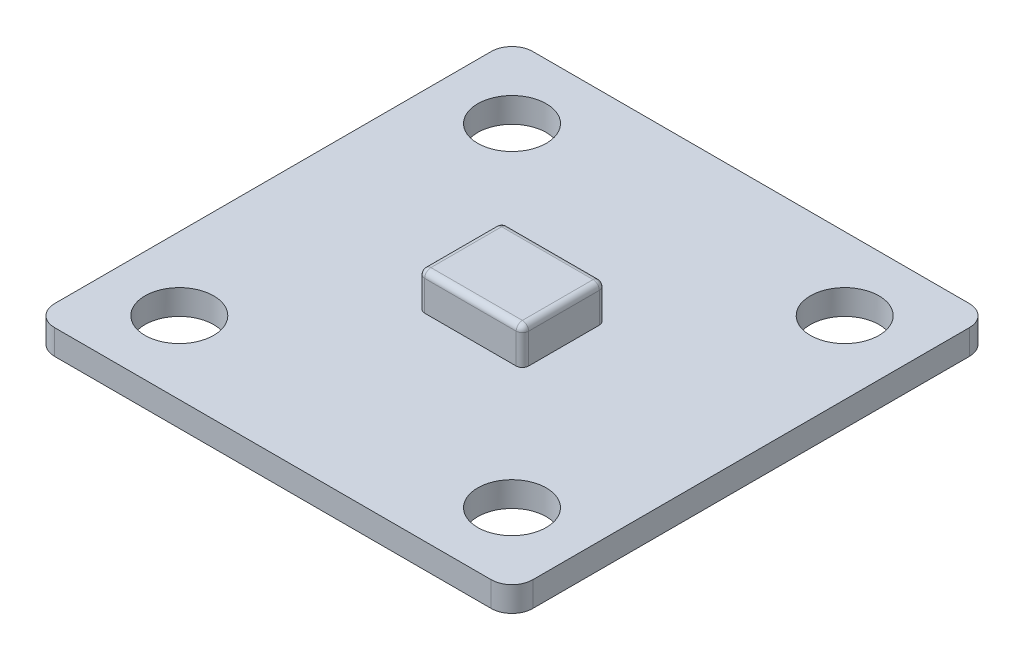
from build123d import *

# Parameters (mm, degrees)
SKETCH1_W           = 23
SKETCH1_H           = 23
BOSS_EXTRUDE1_DEPTH = 1.2
FILLET1_R           = 1
SKETCH2_W           = 5
SKETCH2_H           = 4
BOSS_EXTRUDE2_DEPTH = 1.75
FILLET2_R           = 0.3
SKETCH4_R           = 1.65
CUT_EXTRUDE1_DEPTH  = 1.75


with BuildPart() as part:
    # Sketch1 → Boss-Extrude1 (new body)
    with BuildSketch(Plane(origin=(0, 0, 0), x_dir=(1, 0, 0), z_dir=(0, 1, 0))):
        Rectangle(SKETCH1_W, SKETCH1_H)
    extrude(amount=BOSS_EXTRUDE1_DEPTH)

    # Fillet1
    fillet1_edges = [part.edges().sort_by_distance(p)[0] for p in [
        (11.5, 0.6, 11.5),
        (-11.5, 0.6, 11.5),
        (-11.5, 0.6, -11.5),
        (11.5, 0.6, -11.5),
    ]]
    fillet(fillet1_edges, radius=FILLET1_R)

    # Sketch2 → Boss-Extrude2 (add)
    with BuildSketch(Plane(origin=(0, 1.2, 0), x_dir=(1, 0, 0), z_dir=(0, 1, 0))):
        Rectangle(SKETCH2_W, SKETCH2_H)
    extrude(amount=BOSS_EXTRUDE2_DEPTH)

    # Fillet2
    fillet2_edges = [part.edges().sort_by_distance(p)[0] for p in [
        (2.5, 2.075, 2),
        (2.5, 2.075, -2),
        (-2.5, 2.075, -2),
        (-2.5, 2.075, 2),
        (2.5, 2.95, 0),
        (0, 2.95, -2),
        (-2.5, 2.95, 0),
        (0, 2.95, 2),
    ]]
    fillet(fillet2_edges, radius=FILLET2_R)

    # Sketch4 → Cut-Extrude1 (cut)
    with BuildSketch(Plane(origin=(0, 1.2, 0), x_dir=(1, 0, 0), z_dir=(0, 1, 0))):
        with Locations(Location((-8, 8, 0), (0, 0, 270))):
            Circle(SKETCH4_R)
        with Locations(Location((8, 8, 0), (0, 0, 270))):
            Circle(SKETCH4_R)
        with Locations(Location((8, -8, 0), (0, 0, 270))):
            Circle(SKETCH4_R)
        with Locations(Location((-8, -8, 0), (0, 0, 270))):
            Circle(SKETCH4_R)
    extrude(amount=-CUT_EXTRUDE1_DEPTH, mode=Mode.SUBTRACT)


solid = part.part
